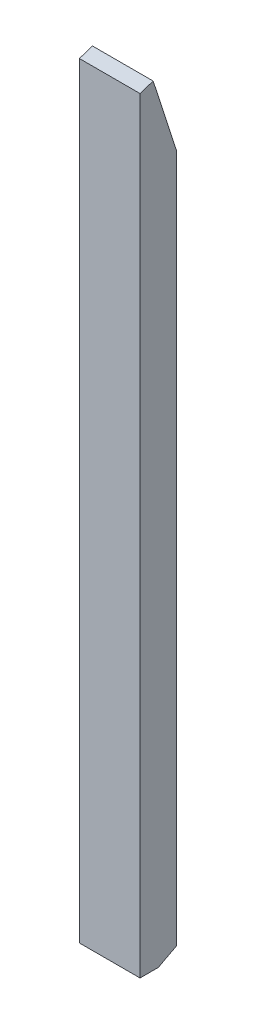
from build123d import *

# Parameters (mm, degrees)
ESQUISSE1_W             = 63
ESQUISSE1_H             = 800
BOSS_EXTRU_1_DEPTH      = 38
ENL_V_MAT_EXTRU_1_DEPTH = 804.376001633
ENL_V_MAT_EXTRU_2_DEPTH = 804.376001633


with BuildPart() as part:
    # Esquisse1 → Boss.-Extru.1 (new body)
    with BuildSketch(Plane.XY):
        with Locations((31.5, 400)):
            Rectangle(ESQUISSE1_W, ESQUISSE1_H)
    extrude(amount=BOSS_EXTRU_1_DEPTH)

    # Esquisse2 → Enlèv. mat.-Extru.1 (cut, through all)
    with BuildSketch(Plane.ZY):
        Polygon((24.368977217, 800), (0, 725), (0, 800), align=None)
        Polygon((19, 0), (0, 10), (0, 0), align=None)
    extrude(amount=-ENL_V_MAT_EXTRU_1_DEPTH, mode=Mode.SUBTRACT)

    # Esquisse3 → Enlèv. mat.-Extru.2 (cut, through all)
    with BuildSketch(Plane.ZY):
        Polygon((24.368977217, 800), (38, 795.571012218), (38, 800), align=None)
    extrude(amount=-ENL_V_MAT_EXTRU_2_DEPTH, mode=Mode.SUBTRACT)


solid = part.part
